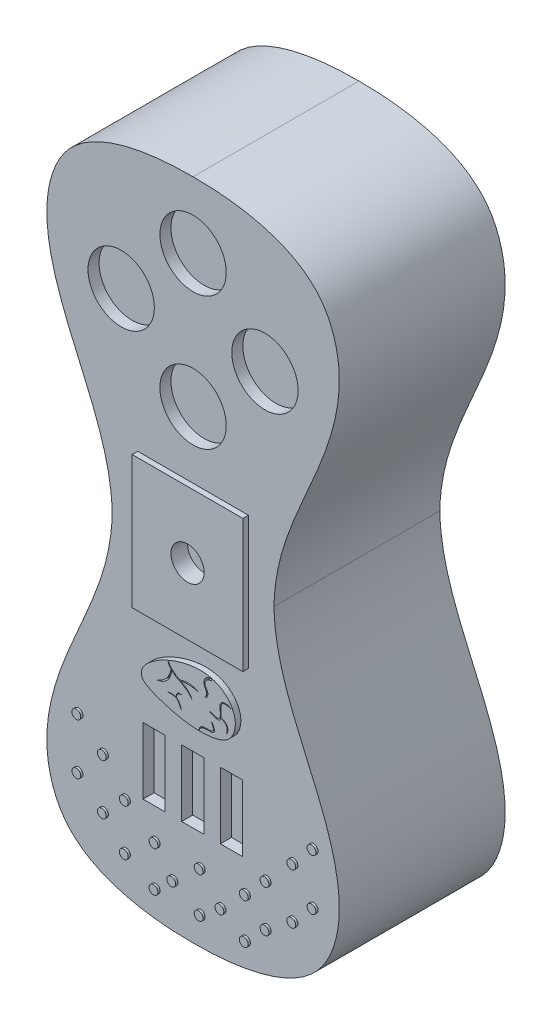
from build123d import *

# Parameters (mm, degrees)
CROQUIS1_W              = 2
CROQUIS1_H              = 6
CROQUIS1_W_2            = 10
CROQUIS1_H_2            = 12
CROQUIS1_R              = 3
SALIENTE_EXTRUIR1_DEPTH = 15
CROQUIS1_5_W            = 2
CROQUIS1_5_H            = 6
CROQUIS1_5_R            = 1.5
CROQUIS1_5_R_2          = 3
SALIENTE_EXTRUIR4_DEPTH = 14
CROQUIS1_6_W            = 10
CROQUIS1_6_H            = 12
CROQUIS1_6_R            = 1.5
SALIENTE_EXTRUIR5_DEPTH = 15.5
CORTAR_EXTRUIR2_START   = -29.5
CORTAR_EXTRUIR2_DEPTH   = 10.5
CROQUIS3_R              = 0.4
SALIENTE_EXTRUIR6_DEPTH = 0.2
SALIENTE_EXTRUIR7_DEPTH = 0.5


with BuildPart() as part:
    # Croquis1 → Saliente-Extruir1 (new body)
    with BuildSketch(Plane.XY):
        with BuildLine():
            add(Edge.make_bspline(
                [(0, 30), (3.517966641, 30.025190931), (10.832527718, 29.245117211), (13.734295935, 21.436348041), (11.949697113, 12.150771658), (7.40701242, 5.684487622), (7.315788173, 0)],
                knots=[0, 0, 0, 0, 0.312024779, 0.415094675, 0.592639362, 1, 1, 1, 1], degree=3))
            add(Edge.make_bspline(
                [(0, 30), (-3.517966641, 30.025190931), (-10.832527718, 29.245117211), (-13.734295935, 21.436348041), (-11.949697113, 12.150771658), (-7.40701242, 5.684487622), (-7.315788173, 0)],
                knots=[0, 0, 0, 0, 0.312024779, 0.415094675, 0.592639362, 1, 1, 1, 1], degree=3))
            add(Edge.make_bspline(
                [(0, -30), (-3.517966641, -30.025190931), (-10.832527718, -29.245117211), (-13.734295935, -21.436348041), (-11.949697113, -12.150771658), (-7.40701242, -5.684487622), (-7.315788173, 0)],
                knots=[0, 0, 0, 0, 0.312024779, 0.415094675, 0.592639362, 1, 1, 1, 1], degree=3))
            add(Edge.make_bspline(
                [(0, -30), (3.517966641, -30.025190931), (10.832527718, -29.245117211), (13.734295935, -21.436348041), (11.949697113, -12.150771658), (7.40701242, -5.684487622), (7.315788173, 0)],
                knots=[0, 0, 0, 0, 0.312024779, 0.415094675, 0.592639362, 1, 1, 1, 1], degree=3))
        make_face()
        with Locations((-3.528555678, -17.999678418)):
            Rectangle(CROQUIS1_W, CROQUIS1_H, mode=Mode.SUBTRACT)
        with Locations((-0.028555678, -17.999678418)):
            Rectangle(CROQUIS1_W, CROQUIS1_H, mode=Mode.SUBTRACT)
        with Locations((3.471444322, -17.999678418)):
            Rectangle(CROQUIS1_W, CROQUIS1_H, mode=Mode.SUBTRACT)
        Rectangle(CROQUIS1_W_2, CROQUIS1_H_2, mode=Mode.SUBTRACT)
        with Locations((0, 12)):
            Circle(CROQUIS1_R, mode=Mode.SUBTRACT)
        with Locations((-6.5, 18)):
            Circle(CROQUIS1_R, mode=Mode.SUBTRACT)
        with Locations((0, 24)):
            Circle(CROQUIS1_R, mode=Mode.SUBTRACT)
        with Locations((6.5, 18)):
            Circle(CROQUIS1_R, mode=Mode.SUBTRACT)
    extrude(amount=SALIENTE_EXTRUIR1_DEPTH)

    # Croquis1<5> → Saliente-Extruir4 (add)
    with BuildSketch(Plane.XY):
        with Locations((3.471444322, -17.999678418)):
            Rectangle(CROQUIS1_5_W, CROQUIS1_5_H)
        with Locations((-0.028555678, -17.999678418)):
            Rectangle(CROQUIS1_5_W, CROQUIS1_5_H)
        with Locations((-3.528555678, -17.999678418)):
            Rectangle(CROQUIS1_5_W, CROQUIS1_5_H)
        Circle(CROQUIS1_5_R)
        with Locations((6.5, 18)):
            Circle(CROQUIS1_5_R_2)
        with Locations((0, 12)):
            Circle(CROQUIS1_5_R_2)
        with Locations((-6.5, 18)):
            Circle(CROQUIS1_5_R_2)
        with Locations((0, 24)):
            Circle(CROQUIS1_5_R_2)
    extrude(amount=SALIENTE_EXTRUIR4_DEPTH)


with BuildPart() as saliente_extruir4_piece_1:
    # of the separate pieces the step leaves, piece 1, a body of its own (saliente_extruir4_pieces)
    add(part.part.solids().sort_by_distance((-7.315788173, 0, 0))[0])



with BuildPart() as saliente_extruir4_piece_2:
    # of the separate pieces the step leaves, piece 2, a body of its own (saliente_extruir4_pieces)
    add(part.part.solids().sort_by_distance((1.5, 0, 0))[0])


with BuildPart() as saliente_extruir4_piece_1_1:
    add(saliente_extruir4_piece_1.part)

    add(saliente_extruir4_piece_2.part)  # Saliente-Extruir5 merges Saliente-Extruir4 piece 2
    # Croquis1<6> → Saliente-Extruir5 (add)
    with BuildSketch(Plane.XY):
        Rectangle(CROQUIS1_6_W, CROQUIS1_6_H)
        Circle(CROQUIS1_6_R, mode=Mode.SUBTRACT)
    extrude(amount=SALIENTE_EXTRUIR5_DEPTH)

    # Croquis2 → Cortar-Extruir2 (cut)
    with BuildSketch(Plane(origin=(0, 0, 0), x_dir=(1, 0, 0), z_dir=(0, 1, 0)).offset(CORTAR_EXTRUIR2_START)):
        Polygon((0, -8.5), (1.2, -8.5), (1.2, -7.5), (0, -7.5), (-1.2, -7.5), (-1.2, -8.5), align=None)
    extrude(amount=-CORTAR_EXTRUIR2_DEPTH, mode=Mode.SUBTRACT)

    # Croquis3 → Saliente-Extruir6 (add)
    with BuildSketch(Plane.XY.offset(15)):
        with Locations((-8.051058991, -23.774553466)):
            Circle(CROQUIS3_R)
        with Locations((-6.064348502, -25.976043467)):
            Circle(CROQUIS3_R)
        with Locations((-3.379604599, -23.774553466)):
            Circle(CROQUIS3_R)
        with Locations((-1.768758257, -25.976043467)):
            Circle(CROQUIS3_R)
        with Locations((0.701206134, -23.774553466)):
            Circle(CROQUIS3_R)
        with Locations((2.580526867, -25.976043467)):
            Circle(CROQUIS3_R)
        with Locations((4.782016867, -23.774553466)):
            Circle(CROQUIS3_R)
        with Locations((6.6613376, -25.576043467)):
            Circle(CROQUIS3_R)
        with Locations((9.077607113, -23.774553466)):
            Circle(CROQUIS3_R)
        with Locations((4.782016867, -27.425805174)):
            Circle(CROQUIS3_R)
        with Locations((0.701206134, -27.425805174)):
            Circle(CROQUIS3_R)
        with Locations((-3.379604599, -27.425805174)):
            Circle(CROQUIS3_R)
        with Locations((-10.359938747, -21.787842977)):
            Circle(CROQUIS3_R)
        with Locations((-8.051058991, -19.21048883)):
            Circle(CROQUIS3_R)
        with Locations((-10.359938747, -17.170083464)):
            Circle(CROQUIS3_R)
        with Locations((-6.064348502, -21.787842977)):
            Circle(CROQUIS3_R)
        with Locations((6.6613376, -21.787842977)):
            Circle(CROQUIS3_R)
        with Locations((10.903232967, -21.787842977)):
            Circle(CROQUIS3_R)
        with Locations((9.077607113, -19.21048883)):
            Circle(CROQUIS3_R)
        with Locations((10.903232967, -17.170083464)):
            Circle(CROQUIS3_R)
    extrude(amount=SALIENTE_EXTRUIR6_DEPTH)

    # Croquis3<3> → Saliente-Extruir7 (add)
    with BuildSketch(Plane.XY.offset(15)):
        with BuildLine():
            add(Edge.make_bspline(
                [(-2.464428715, -11.941126465), (-1.228441124, -12.361448098), (0.460357155, -12.723983751), (2.586496318, -12.552070927), (3.900728806, -11.949830785), (4.836906627, -9.982574718), (1.712439767, -5.950768991), (-6.309471548, -10.472913243), (-3.066891111, -11.736247404), (-2.464428715, -11.941126465)],
                knots=[0, 0, 0, 0, 0.177359323, 0.280438079, 0.308800676, 0.392421659, 0.563603392, 0.913549033, 1, 1, 1, 1], degree=3))
        make_face()
        with BuildLine():
            Line((-1.741892983, -11.003209624), (-1.768758266, -10.98681813))
            add(Edge.make_bspline(
                [(-0.55483778, -11.802972777), (-0.793551668, -10.707427155), (-1.768758266, -10.98681813)],
                knots=[0, 0, 0, 1, 1, 1], degree=2))
            Line((-0.55483778, -11.802972777), (-0.580628124, -11.788079756))
            add(Edge.make_bspline(
                [(-1.741892983, -11.003209624), (-1.503318241, -10.955161376), (-1.089733433, -10.955402922), (-0.743381784, -11.354444838), (-0.660377621, -11.588543444), (-0.580628124, -11.788079756)],
                knots=[0, 0, 0, 0, 0.545868945, 0.587413674, 1, 1, 1, 1], degree=3))
        make_face(mode=Mode.SUBTRACT)
        with BuildLine():
            Line((-1.008643765, -11.025655104), (-1.034209484, -11.010196762))
            add(Edge.make_bspline(
                [(-1.034209484, -11.010196762), (-0.993013963, -10.478472208), (-0.553381286, -10.59858885)],
                knots=[0, 0, 0, 1, 1, 1], degree=2))
            add(Edge.make_bspline(
                [(-1.008643765, -11.025655104), (-0.978246923, -10.595671851), (-0.553381286, -10.59858885)],
                knots=[0, 0, 0, 1, 1, 1], degree=2))
        make_face(mode=Mode.SUBTRACT)
        with BuildLine():
            add(Edge.make_bspline(
                [(-2.778571962, -10.539541182), (-1.692568711, -10.137393481), (-1.492344801, -9.065551362)],
                knots=[0, 0, 0, 1, 1, 1], degree=2))
            Line((-1.492344801, -9.065551362), (-1.442559496, -9.119005059))
            add(Edge.make_bspline(
                [(-1.442559496, -9.119005059), (-1.553140292, -10.345082422), (-2.778571962, -10.539541182)],
                knots=[0, 0, 0, 1, 1, 1], degree=2))
        make_face(mode=Mode.SUBTRACT)
        with BuildLine():
            add(Edge.make_bspline(
                [(-1.768758266, -8.574308186), (-1.443334187, -9.639423362), (0.002551335, -9.576154141), (0.434985134, -10.59858885)],
                knots=[0, 0, 0, 0, 1, 1, 1, 1], degree=3))
            Line((-1.768758266, -8.574308186), (-1.710924559, -8.57051102))
            add(Edge.make_bspline(
                [(-1.710924559, -8.57051102), (-1.318906611, -9.561833651), (0.104118064, -9.49163216), (0.434985134, -10.59858885)],
                knots=[0, 0, 0, 0, 1, 1, 1, 1], degree=3))
        make_face(mode=Mode.SUBTRACT)
        with BuildLine():
            add(Edge.make_bspline(
                [(-0.680873067, -9.50316341), (0.111167069, -9.199470334), (0.932974447, -9.563090303)],
                knots=[0, 0, 0, 1, 1, 1], degree=2))
            Line((0.932974447, -9.563090303), (0.932974447, -9.586780305))
            add(Edge.make_bspline(
                [(-0.615134068, -9.538089615), (0.16111383, -9.369781459), (0.932974447, -9.586780305)],
                knots=[0, 0, 0, 1, 1, 1], degree=2))
            Line((-0.615134068, -9.538089615), (-0.680873067, -9.50316341))
        make_face(mode=Mode.SUBTRACT)
        with BuildLine():
            add(Edge.make_bspline(
                [(1.055625057, -12.474953953), (1.257433112, -11.608266963), (2.814517448, -12.718112945), (2.184136465, -11.366208523)],
                knots=[0, 0, 0, 0, 1, 1, 1, 1], degree=3))
            Line((2.184136465, -11.366208523), (2.239190472, -11.390227524))
            add(Edge.make_bspline(
                [(2.239190472, -11.390227524), (2.985208861, -12.784496581), (1.28741773, -11.671931713), (1.055625057, -12.5555918)],
                knots=[0, 0, 0, 0, 1, 1, 1, 1], degree=3))
            Line((1.055625057, -12.5555918), (1.055625057, -12.474953953))
        make_face(mode=Mode.SUBTRACT)
        with BuildLine():
            add(Edge.make_bspline(
                [(2.184136465, -8.027422115), (1.796379373, -7.896599481), (1.060854908, -8.742684766), (1.967670011, -9.283506081), (1.573839712, -9.685124117)],
                knots=[0, 0, 0, 0, 0.501897179, 1, 1, 1, 1], degree=3))
            Line((2.184136465, -8.027422115), (2.184136465, -8.173235018))
            add(Edge.make_bspline(
                [(2.184136465, -8.173235018), (1.89391328, -8.062594492), (1.307197989, -8.663245284), (1.963847193, -9.158159027), (1.7708366, -9.73630862), (1.573839712, -9.685124117)],
                knots=[0, 0, 0, 0, 0.420924798, 0.741921261, 1, 1, 1, 1], degree=3))
        make_face(mode=Mode.SUBTRACT)
        with BuildLine():
            Line((3.038373162, -10.641486631), (3.043893208, -10.59858885))
            add(Edge.make_bspline(
                [(3.043893208, -10.59858885), (3.887624696, -10.875660638), (3.542899766, -11.637665137)],
                knots=[0, 0, 0, 1, 1, 1], degree=2))
            Line((3.542899766, -11.637665137), (3.542899766, -11.580171127))
            add(Edge.make_bspline(
                [(3.038373162, -10.641486631), (3.725949514, -10.873785526), (3.542899766, -11.580171127)],
                knots=[0, 0, 0, 1, 1, 1], degree=2))
        make_face(mode=Mode.SUBTRACT)
        with BuildLine():
            add(Edge.make_bspline(
                [(4.08690436, -9.553214576), (1.83319931, -8.547442903), (4.258333119, -11.850261984), (1.940068838, -10.59858885)],
                knots=[0, 0, 0, 0, 1, 1, 1, 1], degree=3))
            Line((1.940068838, -10.59858885), (1.994992112, -10.59858885))
            add(Edge.make_bspline(
                [(1.994992112, -10.59858885), (2.134185913, -10.621442091), (2.951559936, -11.058323872), (2.999621137, -10.104323775), (2.838378508, -9.457869401), (3.544966861, -9.175398328), (3.883645912, -9.441377953), (4.08690436, -9.553214576)],
                knots=[0, 0, 0, 0, 0.257518778, 0.429652606, 0.660166379, 0.781442002, 1, 1, 1, 1], degree=3))
        make_face(mode=Mode.SUBTRACT)
    extrude(amount=SALIENTE_EXTRUIR7_DEPTH)


solid = saliente_extruir4_piece_1_1.part
